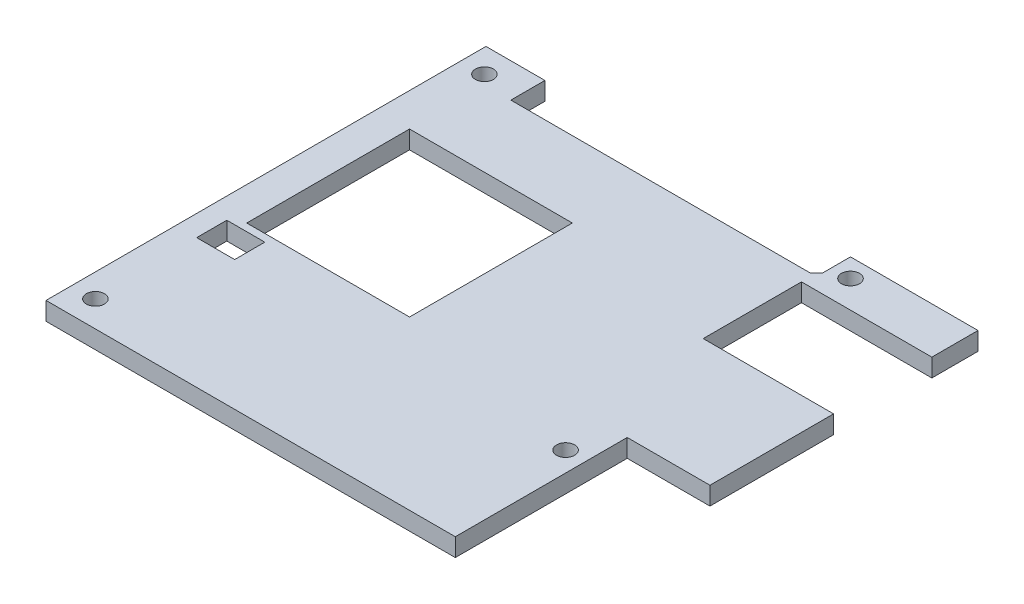
from build123d import *

# Parameters (mm, degrees)
SKETCH_1_R      = 1.5
SKETCH_1_W      = 6.3
SKETCH_1_H      = 5
SKETCH_1_W_2    = 27
SKETCH_1_H_2    = 27
EXTRUDE_1_DEPTH = 3
CHAMFER_1_SIZE  = 1


with BuildPart() as part:
    # 草图1 → 凸台-拉伸1 (new body)
    with BuildSketch(Plane(origin=(0, 0, 0), x_dir=(1, 0, 0), z_dir=(0, 1, 0))):
        Polygon((-7.176, 56.452), (-7.176, -16.51), (60.7, -16.51), (60.7, 12), (74.421, 12), (74.421, 32.5), (52.8, 32.5), (52.8, 48.8), (74.421, 48.8), (74.421, 56.452), (53.276, 56.452), (53.276, 50.8), (2.6, 50.8), (2.6, 56.452), align=None)
        with Locations(Location((-3.302, -12.192, 0), (0, 0, 270))):
            Circle(SKETCH_1_R, mode=Mode.SUBTRACT)
        with Locations((-0.55, 7.5)):
            Rectangle(SKETCH_1_W, SKETCH_1_H, mode=Mode.SUBTRACT)
        with Locations(Location((57.404, 5.08, 0), (0, 0, 270))):
            Circle(SKETCH_1_R, mode=Mode.SUBTRACT)
        with Locations((11.85, 24.75)):
            Rectangle(SKETCH_1_W_2, SKETCH_1_H_2, mode=Mode.SUBTRACT)
        with Locations(Location((-3.302, 52.324, 0), (0, 0, 270))):
            Circle(SKETCH_1_R, mode=Mode.SUBTRACT)
        with Locations(Location((56.388, 53.34, 0), (0, 0, 270))):
            Circle(SKETCH_1_R, mode=Mode.SUBTRACT)
    extrude(amount=EXTRUDE_1_DEPTH)

    # 倒角1
    chamfer_1_edges = [part.edges().sort_by_distance(p)[0] for p in [
        (53.276, 1.5, -50.8),
    ]]
    chamfer(chamfer_1_edges, length=CHAMFER_1_SIZE)


solid = part.part
